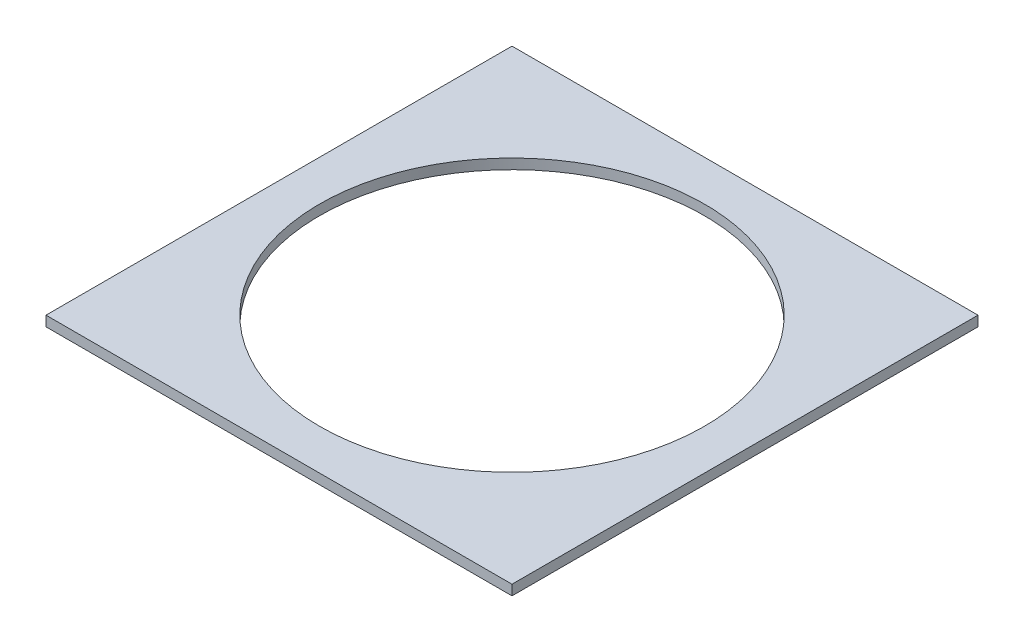
from build123d import *

# Parameters (mm, degrees)
SKETCH1_W           = 292.1
SKETCH1_H           = 292.1
BOSS_EXTRUDE1_DEPTH = 6.35
SKETCH2_R           = 120.65
CUT_EXTRUDE1_DEPTH  = 6.35


with BuildPart() as part:
    # Sketch1 → Boss-Extrude1 (new body)
    with BuildSketch(Plane(origin=(0, 0, 0), x_dir=(1, 0, 0), z_dir=(0, 1, 0))):
        Rectangle(SKETCH1_W, SKETCH1_H)
    extrude(amount=BOSS_EXTRUDE1_DEPTH)

    # Sketch2 → Cut-Extrude1 (cut)
    with BuildSketch(Plane(origin=(0, 6.35, 0), x_dir=(1, 0, 0), z_dir=(0, 1, 0))):
        with Locations(Location((0, 0, 0), (0, 0, 270))):
            Circle(SKETCH2_R)
    extrude(amount=-CUT_EXTRUDE1_DEPTH, mode=Mode.SUBTRACT)


solid = part.part
